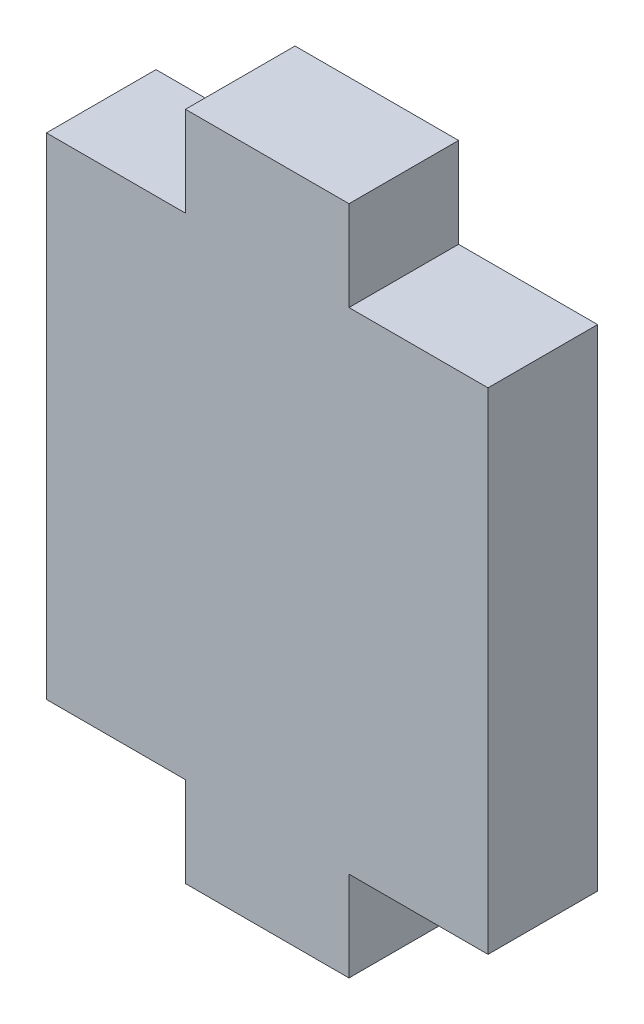
from build123d import *

# Parameters (mm, degrees)
BOSS_EXTRUDE1_DEPTH = 6.7


with BuildPart() as part:
    # Sketch1 → Boss-Extrude1 (new body)
    with BuildSketch(Plane.XY):
        Polygon((5, -15), (13.5, -15), (13.5, 15), (5, 15), (5, 20.5), (-5, 20.5), (-5, 15), (-13.5, 15), (-13.5, -15), (-5, -15), (-5, -20.5), (5, -20.5), align=None)
    extrude(amount=BOSS_EXTRUDE1_DEPTH)


solid = part.part
